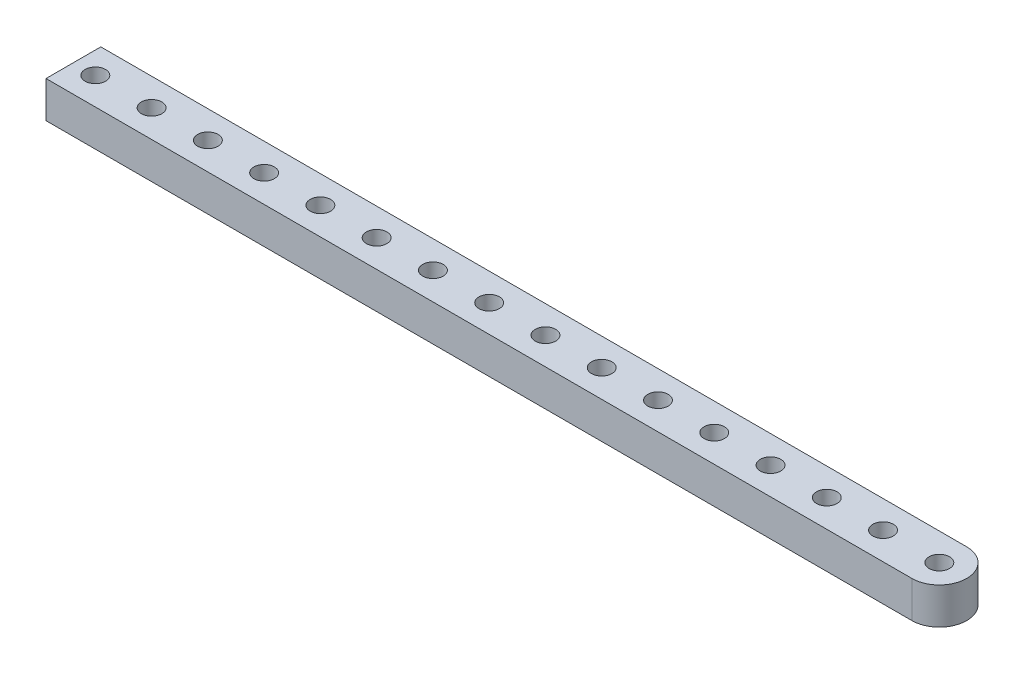
from build123d import *

# Parameters (mm, degrees)
SKETCH1_R           = 1.778
BOSS_EXTRUDE1_DEPTH = 6.35
SKETCH2_W           = 10.758447183
SKETCH2_H           = 9.8425
CUT_EXTRUDE1_DEPTH  = 84.373202748


with BuildPart() as part:
    # Sketch1 → Boss-Extrude1 (new body)
    with BuildSketch(Plane(origin=(0, 6.35, 0), x_dir=(1, 0, 0), z_dir=(0, 1, 0))):
        with BuildLine():
            Line((78.232, 4.7625), (-78.232, 4.7625))
            ThreePointArc((-78.232, 4.7625), (-82.9945, 0), (-78.232, -4.7625))
            Line((-78.232, -4.7625), (78.232, -4.7625))
            ThreePointArc((78.232, -4.7625), (82.9945, 0), (78.232, 4.7625))
        make_face()
        with Locations(Location((78.232, 0, 0), (0, 0, 90))):
            Circle(SKETCH1_R, mode=Mode.SUBTRACT)
        with Locations(Location((68.453, 0, 0), (0, 0, 90))):
            Circle(SKETCH1_R, mode=Mode.SUBTRACT)
        with Locations(Location((58.674, 0, 0), (0, 0, 90))):
            Circle(SKETCH1_R, mode=Mode.SUBTRACT)
        with Locations(Location((48.895, 0, 0), (0, 0, 90))):
            Circle(SKETCH1_R, mode=Mode.SUBTRACT)
        with Locations(Location((39.116, 0, 0), (0, 0, 90))):
            Circle(SKETCH1_R, mode=Mode.SUBTRACT)
        with Locations(Location((29.337, 0, 0), (0, 0, 90))):
            Circle(SKETCH1_R, mode=Mode.SUBTRACT)
        with Locations(Location((19.558, 0, 0), (0, 0, 90))):
            Circle(SKETCH1_R, mode=Mode.SUBTRACT)
        with Locations(Location((9.779, 0, 0), (0, 0, 90))):
            Circle(SKETCH1_R, mode=Mode.SUBTRACT)
        with Locations(Location((0, 0, 0), (0, 0, 90))):
            Circle(SKETCH1_R, mode=Mode.SUBTRACT)
        with Locations(Location((-9.779, 0, 0), (0, 0, 90))):
            Circle(SKETCH1_R, mode=Mode.SUBTRACT)
        with Locations(Location((-19.558, 0, 0), (0, 0, 90))):
            Circle(SKETCH1_R, mode=Mode.SUBTRACT)
        with Locations(Location((-29.337, 0, 0), (0, 0, 90))):
            Circle(SKETCH1_R, mode=Mode.SUBTRACT)
        with Locations(Location((-39.116, 0, 0), (0, 0, 90))):
            Circle(SKETCH1_R, mode=Mode.SUBTRACT)
        with Locations(Location((-48.895, 0, 0), (0, 0, 90))):
            Circle(SKETCH1_R, mode=Mode.SUBTRACT)
        with Locations(Location((-58.674, 0, 0), (0, 0, 90))):
            Circle(SKETCH1_R, mode=Mode.SUBTRACT)
        with Locations(Location((-68.453, 0, 0), (0, 0, 90))):
            Circle(SKETCH1_R, mode=Mode.SUBTRACT)
        with Locations(Location((-78.232, 0, 0), (0, 0, 90))):
            Circle(SKETCH1_R, mode=Mode.SUBTRACT)
    extrude(amount=-BOSS_EXTRUDE1_DEPTH)

    # Sketch2 → Cut-Extrude1 (cut, through all)
    with BuildSketch(Plane(origin=(0, 6.35, 0), x_dir=(1, 0, 0), z_dir=(0, 1, 0))):
        with Locations((-77.642223591, 0.15875)):
            Rectangle(SKETCH2_W, SKETCH2_H)
    extrude(amount=-CUT_EXTRUDE1_DEPTH, mode=Mode.SUBTRACT)


solid = part.part
